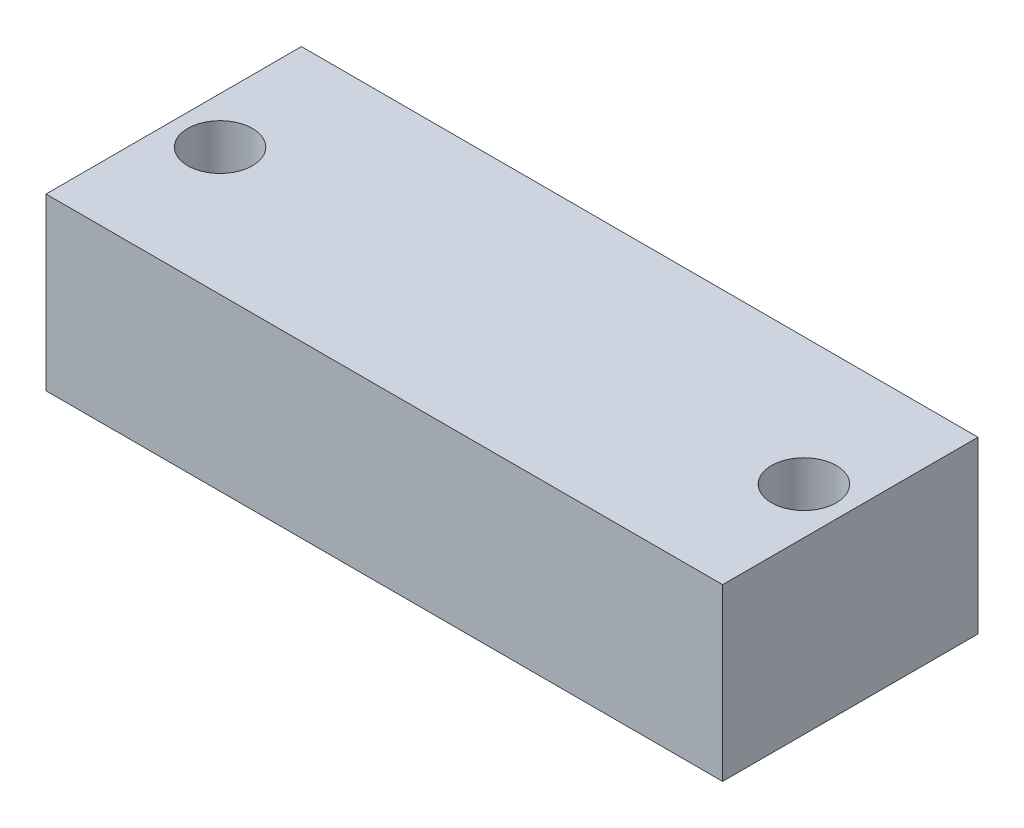
from build123d import *

# Parameters (mm, degrees)
SKETCH1_W                                           = 79.6671
SKETCH1_H                                           = 30.0736
BOSS_EXTRUDE1_DEPTH                                 = 20.066
CBORE_FOR_8_BINDING_HEAD_MACHINE_SCREW2_D           = 4.699999998
CBORE_FOR_8_BINDING_HEAD_MACHINE_SCREW2_CBORE_D     = 7.62
CBORE_FOR_8_BINDING_HEAD_MACHINE_SCREW2_CBORE_DEPTH = 14.224


with BuildPart() as part:
    # Sketch1 → Boss-Extrude1 (new body)
    with BuildSketch(Plane(origin=(0, 0, 0), x_dir=(1, 0, 0), z_dir=(0, 1, 0))):
        with Locations((39.83355, 15.0368)):
            Rectangle(SKETCH1_W, SKETCH1_H)
    extrude(amount=BOSS_EXTRUDE1_DEPTH)

    # CBORE for #8 Binding Head Machine Screw2 (through all)
    with Locations(Plane(origin=(0, 20.066, 0), x_dir=(1, 0, 0), z_dir=(0, 1, 0))):
        with Locations((5.461, 15.0368), (74.2061, 15.0368)):
            CounterBoreHole(CBORE_FOR_8_BINDING_HEAD_MACHINE_SCREW2_D / 2, CBORE_FOR_8_BINDING_HEAD_MACHINE_SCREW2_CBORE_D / 2, CBORE_FOR_8_BINDING_HEAD_MACHINE_SCREW2_CBORE_DEPTH)


solid = part.part
